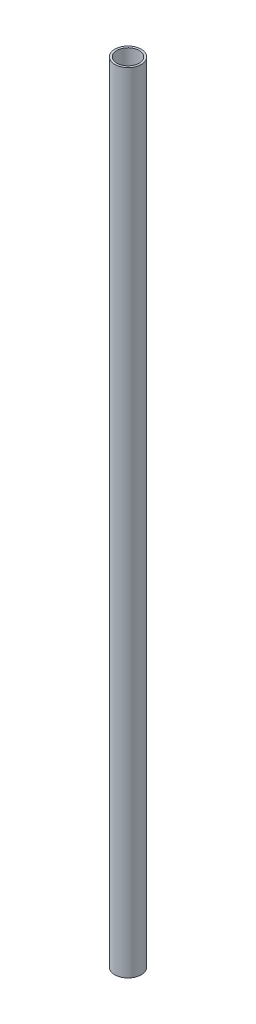
from build123d import *

# Parameters (mm, degrees)
SKETCH1_R           = 7.75
SKETCH1_R_2         = 6.5
BOSS_EXTRUDE1_DEPTH = 441
BOSS_EXTRUDE3_START = -20.476429663
SKETCH1_2_R         = 7.75
SKETCH1_2_R_2       = 6.5
BOSS_EXTRUDE3_DEPTH = 20.476429663


with BuildPart() as part:
    # Sketch1 → Boss-Extrude1 (new body)
    with BuildSketch(Plane(origin=(0, 0, 0), x_dir=(1, 0, 0), z_dir=(0, 1, 0))):
        Circle(SKETCH1_R)
        Circle(SKETCH1_R_2, mode=Mode.SUBTRACT)
    extrude(amount=BOSS_EXTRUDE1_DEPTH)

    # Sketch1<2> → Boss-Extrude3 (add)
    with BuildSketch(Plane(origin=(0, 0, 0), x_dir=(1, 0, 0), z_dir=(0, 1, 0)).offset(BOSS_EXTRUDE3_START)):
        Circle(SKETCH1_2_R)
        Circle(SKETCH1_2_R_2, mode=Mode.SUBTRACT)
    extrude(amount=BOSS_EXTRUDE3_DEPTH)


solid = part.part
